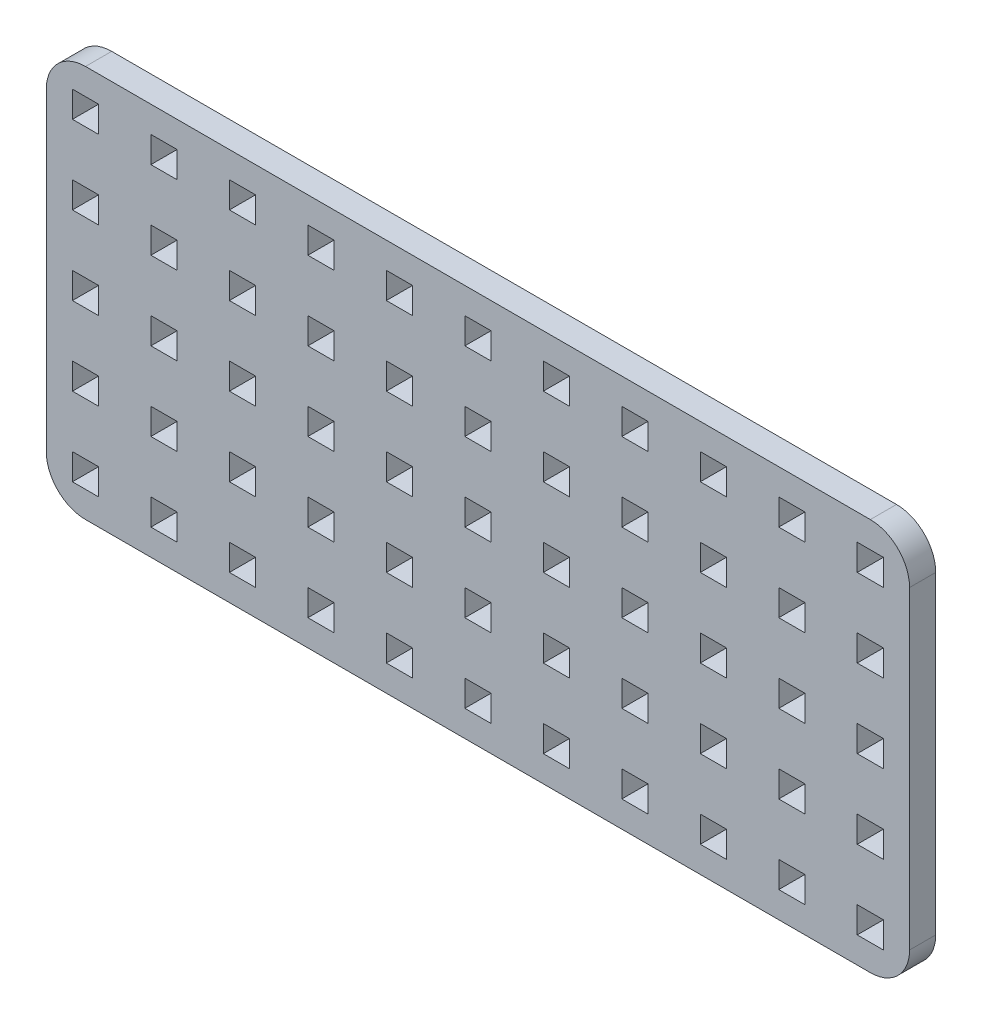
from build123d import *

# Parameters (mm, degrees)
MODEL_W                 = 3
MODEL_H                 = 3
SALIENTE_EXTRUIR1_DEPTH = 3


with BuildPart() as part:
    # Model → Saliente-Extruir1 (new body)
    with BuildSketch(Plane.XY):
        with BuildLine():
            Line((104.4201517, 259.741779533), (104.4201517, 295.741779533))
            ThreePointArc((104.4201517, 295.741779533), (103.102132215, 298.923760049), (99.9201517, 300.241779533))
            Line((99.9201517, 300.241779533), (9.9201517, 300.241779533))
            ThreePointArc((9.9201517, 300.241779533), (6.738171185, 298.923760049), (5.4201517, 295.741779533))
            Line((5.4201517, 295.741779533), (5.4201517, 259.741779533))
            ThreePointArc((5.4201517, 259.741779533), (6.738171185, 256.559799018), (9.9201517, 255.241779533))
            Line((9.9201517, 255.241779533), (99.9201517, 255.241779533))
            ThreePointArc((99.9201517, 255.241779533), (103.102132215, 256.559799018), (104.4201517, 259.741779533))
        make_face()
        with Locations((9.9201517, 295.741779533)):
            Rectangle(MODEL_W, MODEL_H, mode=Mode.SUBTRACT)
        with Locations((18.9201517, 295.741779533)):
            Rectangle(MODEL_W, MODEL_H, mode=Mode.SUBTRACT)
        with Locations((27.9201517, 295.741779533)):
            Rectangle(MODEL_W, MODEL_H, mode=Mode.SUBTRACT)
        with Locations((36.9201517, 295.741779533)):
            Rectangle(MODEL_W, MODEL_H, mode=Mode.SUBTRACT)
        with Locations((45.9201517, 295.741779533)):
            Rectangle(MODEL_W, MODEL_H, mode=Mode.SUBTRACT)
        with Locations((54.9201517, 295.741779533)):
            Rectangle(MODEL_W, MODEL_H, mode=Mode.SUBTRACT)
        with Locations((63.9201517, 295.741779533)):
            Rectangle(MODEL_W, MODEL_H, mode=Mode.SUBTRACT)
        with Locations((72.9201517, 295.741779533)):
            Rectangle(MODEL_W, MODEL_H, mode=Mode.SUBTRACT)
        with Locations((81.9201517, 295.741779533)):
            Rectangle(MODEL_W, MODEL_H, mode=Mode.SUBTRACT)
        with Locations((90.9201517, 295.741779533)):
            Rectangle(MODEL_W, MODEL_H, mode=Mode.SUBTRACT)
        with Locations((99.9201517, 295.741779533)):
            Rectangle(MODEL_W, MODEL_H, mode=Mode.SUBTRACT)
        with Locations((9.9201517, 259.741779533)):
            Rectangle(MODEL_W, MODEL_H, mode=Mode.SUBTRACT)
        with Locations((18.9201517, 259.741779533)):
            Rectangle(MODEL_W, MODEL_H, mode=Mode.SUBTRACT)
        with Locations((27.9201517, 259.741779533)):
            Rectangle(MODEL_W, MODEL_H, mode=Mode.SUBTRACT)
        with Locations((36.9201517, 259.741779533)):
            Rectangle(MODEL_W, MODEL_H, mode=Mode.SUBTRACT)
        with Locations((45.9201517, 259.741779533)):
            Rectangle(MODEL_W, MODEL_H, mode=Mode.SUBTRACT)
        with Locations((54.9201517, 259.741779533)):
            Rectangle(MODEL_W, MODEL_H, mode=Mode.SUBTRACT)
        with Locations((63.9201517, 259.741779533)):
            Rectangle(MODEL_W, MODEL_H, mode=Mode.SUBTRACT)
        with Locations((72.9201517, 259.741779533)):
            Rectangle(MODEL_W, MODEL_H, mode=Mode.SUBTRACT)
        with Locations((81.9201517, 259.741779533)):
            Rectangle(MODEL_W, MODEL_H, mode=Mode.SUBTRACT)
        with Locations((90.9201517, 259.741779533)):
            Rectangle(MODEL_W, MODEL_H, mode=Mode.SUBTRACT)
        with Locations((99.9201517, 259.741779533)):
            Rectangle(MODEL_W, MODEL_H, mode=Mode.SUBTRACT)
        with Locations((99.9201517, 286.741779533)):
            Rectangle(MODEL_W, MODEL_H, mode=Mode.SUBTRACT)
        with Locations((99.9201517, 268.741779533)):
            Rectangle(MODEL_W, MODEL_H, mode=Mode.SUBTRACT)
        with Locations((99.9201517, 277.741779533)):
            Rectangle(MODEL_W, MODEL_H, mode=Mode.SUBTRACT)
        with Locations((81.9201517, 286.741779533)):
            Rectangle(MODEL_W, MODEL_H, mode=Mode.SUBTRACT)
        with Locations((81.9201517, 268.741779533)):
            Rectangle(MODEL_W, MODEL_H, mode=Mode.SUBTRACT)
        with Locations((81.9201517, 277.741779533)):
            Rectangle(MODEL_W, MODEL_H, mode=Mode.SUBTRACT)
        with Locations((90.9201517, 286.741779533)):
            Rectangle(MODEL_W, MODEL_H, mode=Mode.SUBTRACT)
        with Locations((90.9201517, 268.741779533)):
            Rectangle(MODEL_W, MODEL_H, mode=Mode.SUBTRACT)
        with Locations((90.9201517, 277.741779533)):
            Rectangle(MODEL_W, MODEL_H, mode=Mode.SUBTRACT)
        with Locations((9.9201517, 286.741779533)):
            Rectangle(MODEL_W, MODEL_H, mode=Mode.SUBTRACT)
        with Locations((9.9201517, 268.741779533)):
            Rectangle(MODEL_W, MODEL_H, mode=Mode.SUBTRACT)
        with Locations((9.9201517, 277.741779533)):
            Rectangle(MODEL_W, MODEL_H, mode=Mode.SUBTRACT)
        with Locations((18.9201517, 268.741779533)):
            Rectangle(MODEL_W, MODEL_H, mode=Mode.SUBTRACT)
        with Locations((27.9201517, 268.741779533)):
            Rectangle(MODEL_W, MODEL_H, mode=Mode.SUBTRACT)
        with Locations((36.9201517, 268.741779533)):
            Rectangle(MODEL_W, MODEL_H, mode=Mode.SUBTRACT)
        with Locations((63.9201517, 268.741779533)):
            Rectangle(MODEL_W, MODEL_H, mode=Mode.SUBTRACT)
        with Locations((72.9201517, 268.741779533)):
            Rectangle(MODEL_W, MODEL_H, mode=Mode.SUBTRACT)
        with Locations((45.9201517, 268.741779533)):
            Rectangle(MODEL_W, MODEL_H, mode=Mode.SUBTRACT)
        with Locations((54.9201517, 268.741779533)):
            Rectangle(MODEL_W, MODEL_H, mode=Mode.SUBTRACT)
        with Locations((18.9201517, 277.741779533)):
            Rectangle(MODEL_W, MODEL_H, mode=Mode.SUBTRACT)
        with Locations((27.9201517, 277.741779533)):
            Rectangle(MODEL_W, MODEL_H, mode=Mode.SUBTRACT)
        with Locations((36.9201517, 277.741779533)):
            Rectangle(MODEL_W, MODEL_H, mode=Mode.SUBTRACT)
        with Locations((63.9201517, 277.741779533)):
            Rectangle(MODEL_W, MODEL_H, mode=Mode.SUBTRACT)
        with Locations((72.9201517, 277.741779533)):
            Rectangle(MODEL_W, MODEL_H, mode=Mode.SUBTRACT)
        with Locations((18.9201517, 286.741779533)):
            Rectangle(MODEL_W, MODEL_H, mode=Mode.SUBTRACT)
        with Locations((27.9201517, 286.741779533)):
            Rectangle(MODEL_W, MODEL_H, mode=Mode.SUBTRACT)
        with Locations((36.9201517, 286.741779533)):
            Rectangle(MODEL_W, MODEL_H, mode=Mode.SUBTRACT)
        with Locations((63.9201517, 286.741779533)):
            Rectangle(MODEL_W, MODEL_H, mode=Mode.SUBTRACT)
        with Locations((72.9201517, 286.741779533)):
            Rectangle(MODEL_W, MODEL_H, mode=Mode.SUBTRACT)
        with Locations((45.9201517, 277.741779533)):
            Rectangle(MODEL_W, MODEL_H, mode=Mode.SUBTRACT)
        with Locations((54.9201517, 277.741779533)):
            Rectangle(MODEL_W, MODEL_H, mode=Mode.SUBTRACT)
        with Locations((45.9201517, 286.741779533)):
            Rectangle(MODEL_W, MODEL_H, mode=Mode.SUBTRACT)
        with Locations((54.9201517, 286.741779533)):
            Rectangle(MODEL_W, MODEL_H, mode=Mode.SUBTRACT)
    extrude(amount=SALIENTE_EXTRUIR1_DEPTH)


solid = part.part
